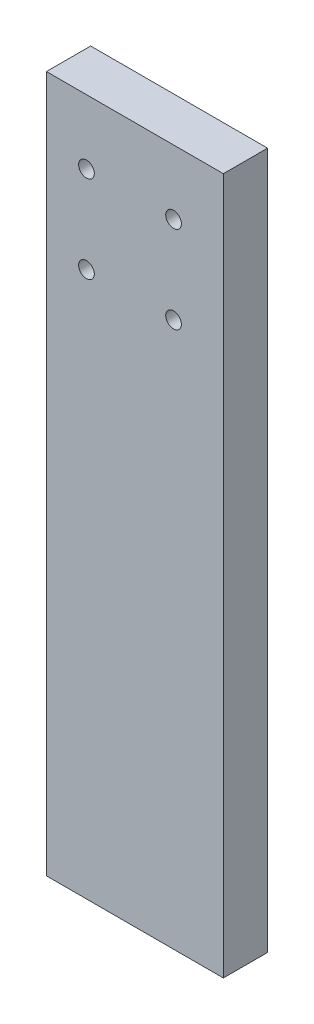
from build123d import *

# Parameters (mm, degrees)
CROQUIS1_W              = 50.8
CROQUIS1_H              = 200
CROQUIS1_R              = 2.25
SALIENTE_EXTRUIR1_DEPTH = 12.7
CROQUIS2_R              = 1.5
CORTAR_EXTRUIR1_DEPTH   = 20


with BuildPart() as part:
    # Croquis1 → Saliente-Extruir1 (new body)
    with BuildSketch(Plane.XY):
        with Locations((1.4, -38)):
            Rectangle(CROQUIS1_W, CROQUIS1_H)
        with Locations((-12.5, 43.5)):
            Circle(CROQUIS1_R, mode=Mode.SUBTRACT)
        with Locations((12.5, 43.5)):
            Circle(CROQUIS1_R, mode=Mode.SUBTRACT)
        with Locations((12.5, 18.5)):
            Circle(CROQUIS1_R, mode=Mode.SUBTRACT)
        with Locations((-12.5, 18.5)):
            Circle(CROQUIS1_R, mode=Mode.SUBTRACT)
    extrude(amount=SALIENTE_EXTRUIR1_DEPTH)

    # Croquis2 → Cortar-Extruir1 (cut)
    with BuildSketch(Plane.XZ.offset(138)):
        with Locations(Location((-13.6, 6.35, 0), (0, 0, 270))):
            Circle(CROQUIS2_R)
        with Locations(Location((16.4, 6.35, 0), (0, 0, 270))):
            Circle(CROQUIS2_R)
    extrude(amount=-CORTAR_EXTRUIR1_DEPTH, mode=Mode.SUBTRACT)


solid = part.part
